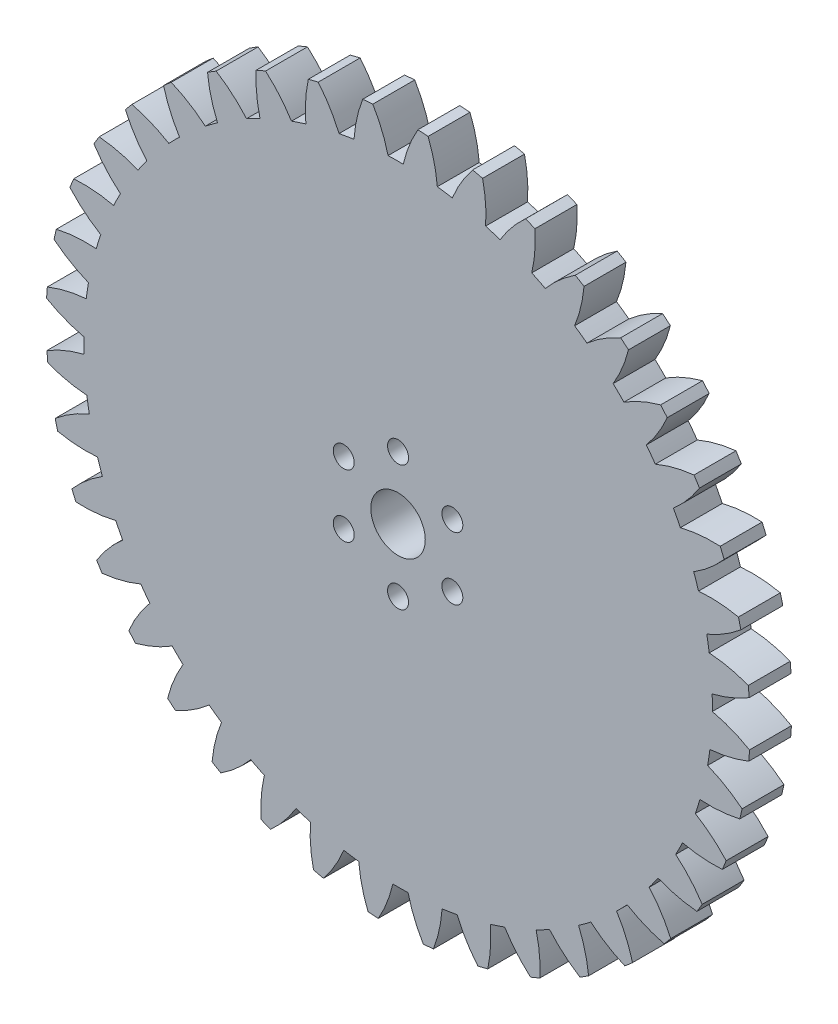
from build123d import *

# Parameters (mm, degrees)
SKETCH1_R           = 1.5875
SKETCH1_R_2         = 4.125
BOSS_EXTRUDE1_DEPTH = 6.35


with BuildPart() as part:
    # Sketch1 → Boss-Extrude1 (new body)
    with BuildSketch(Plane.XY):
        with BuildLine():
            ThreePointArc((-53.25531002, 3.004588931), (-50.519604915, 1.682221979), (-47.617299719, 0.782576864))
            ThreePointArc((-47.617299719, 0.782576864), (-47.622325401, -0.365762868), (-47.599661726, -1.513889932))
            ThreePointArc((-47.599661726, -1.513889932), (-50.487805909, -2.458008545), (-53.202876617, -3.822240134))
            ThreePointArc((-53.202876617, -3.822240134), (-53.141860267, -4.59328721), (-53.069670044, -5.363368478))
            ThreePointArc((-53.069670044, -5.363368478), (-50.160782241, -6.241496333), (-47.153473737, -6.676044764))
            ThreePointArc((-47.153473737, -6.676044764), (-46.978797632, -7.811032718), (-46.776806341, -8.941479053))
            ThreePointArc((-46.776806341, -8.941479053), (-49.481699987, -10.325779289), (-51.94993083, -12.097945558))
            ThreePointArc((-51.94993083, -12.097945558), (-51.769047356, -12.849954704), (-51.577278663, -13.599261955))
            ThreePointArc((-51.577278663, -13.599261955), (-48.566834635, -14.011528292), (-45.528572737, -13.970280013))
            ThreePointArc((-45.528572737, -13.970280013), (-45.178495952, -15.06396902), (-44.802150741, -16.148899285))
            ThreePointArc((-44.802150741, -16.148899285), (-47.257190391, -17.939295078), (-49.417805334, -20.075759411))
            ThreePointArc((-49.417805334, -20.075759411), (-49.121508687, -20.790213667), (-48.814883506, -21.50029647))
            ThreePointArc((-48.814883506, -21.50029647), (-45.777010376, -21.436549923), (-42.782607176, -20.920520604))
            ThreePointArc((-42.782607176, -20.920520604), (-42.265749762, -21.945980409), (-41.7243175, -22.958680021))
            ThreePointArc((-41.7243175, -22.958680021), (-43.869051929, -25.111085885), (-45.668849463, -27.55924144))
            ThreePointArc((-45.668849463, -27.55924144), (-45.264435449, -28.218548571), (-44.85050391, -28.87192233))
            ThreePointArc((-44.85050391, -28.87192233), (-41.860004196, -28.333732551), (-38.983191839, -27.355628546))
            ThreePointArc((-38.983191839, -27.355628546), (-38.312280542, -28.287608927), (-37.619093087, -29.203141859))
            ThreePointArc((-37.619093087, -29.203141859), (-39.400711816, -31.664558419), (-40.795374951, -34.36412348))
            ThreePointArc((-40.795374951, -34.36412348), (-40.292801587, -34.952049157), (-39.781756057, -35.532625642))
            ThreePointArc((-39.781756057, -35.532625642), (-36.912265787, -34.533244649), (-34.223880941, -33.117150126))
            ThreePointArc((-34.223880941, -33.117150126), (-33.415435823, -33.932702631), (-32.587561751, -34.728525425))
            ThreePointArc((-32.587561751, -34.728525425), (-33.962195415, -37.438344436), (-34.917382916, -40.322846753))
            ThreePointArc((-34.917382916, -40.322846753), (-34.329025225, -40.824914293), (-33.733449343, -41.318397784))
            ThreePointArc((-33.733449343, -41.318397784), (-31.05562489, -39.882433654), (-28.621864512, -38.06321756))
            ThreePointArc((-28.621864512, -38.06321756), (-27.695792175, -38.742260581), (-26.753616493, -39.398777438))
            ThreePointArc((-26.753616493, -39.398777438), (-27.687417049, -42.290274162), (-28.17960903, -45.288687715))
            ThreePointArc((-28.17960903, -45.288687715), (-27.519954331, -45.69253455), (-26.85451315, -46.086773845))
            ThreePointArc((-26.85451315, -46.086773845), (-24.434291441, -44.249584781), (-22.315082788, -42.072042252))
            ThreePointArc((-22.315082788, -42.072042252), (-21.294186206, -42.597855497), (-20.260908408, -43.098900794))
            ThreePointArc((-20.260908408, -43.098900794), (-20.730882585, -46.100876985), (-20.747959646, -49.13937088))
            ThreePointArc((-20.747959646, -49.13937088), (-20.033250828, -49.435052961), (-19.314329719, -49.720340581))
            ThreePointArc((-19.314329719, -49.720340581), (-17.211304643, -47.527164275), (-15.458829666, -45.044913636))
            ThreePointArc((-15.458829666, -45.044913636), (-14.368246702, -45.404549836), (-13.269309515, -45.737786174))
            ThreePointArc((-13.269309515, -45.737786174), (-13.263884991, -48.776323216), (-12.805426638, -51.780079651))
            ThreePointArc((-12.805426638, -51.780079651), (-12.053262203, -51.960316303), (-11.298563389, -52.12962752))
            ThreePointArc((-11.298563389, -52.12962752), (-9.564518404, -49.63446725), (-8.221928853, -46.90862975))
            ThreePointArc((-8.221928853, -46.90862975), (-7.088513278, -47.09323347), (-5.950976183, -47.250455464))
            ThreePointArc((-5.950976183, -47.250455464), (-5.470286528, -50.25073449), (-4.547581527, -53.145791012))
            ThreePointArc((-4.547581527, -53.145791012), (-3.77648226, -53.20614421), (-3.004588931, -53.25531002))
            ThreePointArc((-3.004588931, -53.25531002), (-1.682221979, -50.519604915), (-0.782576864, -47.617299719))
            ThreePointArc((-0.782576864, -47.617299719), (0.365762868, -47.622325401), (1.513889932, -47.599661726))
            ThreePointArc((1.513889932, -47.599661726), (2.458008545, -50.487805909), (3.822240134, -53.202876617))
            ThreePointArc((3.822240134, -53.202876617), (4.59328721, -53.141860267), (5.363368478, -53.069670044))
            ThreePointArc((5.363368478, -53.069670044), (6.241496333, -50.160782241), (6.676044764, -47.153473737))
            ThreePointArc((6.676044764, -47.153473737), (7.811032718, -46.978797632), (8.941479053, -46.776806341))
            ThreePointArc((8.941479053, -46.776806341), (10.325779289, -49.481699987), (12.097945558, -51.94993083))
            ThreePointArc((12.097945558, -51.94993083), (12.849954704, -51.769047356), (13.599261955, -51.577278663))
            ThreePointArc((13.599261955, -51.577278663), (14.011528292, -48.566834635), (13.970280013, -45.528572737))
            ThreePointArc((13.970280013, -45.528572737), (15.06396902, -45.178495952), (16.148899285, -44.802150741))
            ThreePointArc((16.148899285, -44.802150741), (17.939295078, -47.257190391), (20.075759411, -49.417805334))
            ThreePointArc((20.075759411, -49.417805334), (20.790213667, -49.121508687), (21.50029647, -48.814883506))
            ThreePointArc((21.50029647, -48.814883506), (21.436549923, -45.777010376), (20.920520604, -42.782607176))
            ThreePointArc((20.920520604, -42.782607176), (21.945980409, -42.265749762), (22.958680021, -41.7243175))
            ThreePointArc((22.958680021, -41.7243175), (25.111085885, -43.869051929), (27.55924144, -45.668849463))
            ThreePointArc((27.55924144, -45.668849463), (28.218548571, -45.264435449), (28.87192233, -44.85050391))
            ThreePointArc((28.87192233, -44.85050391), (28.333732551, -41.860004196), (27.355628546, -38.983191839))
            ThreePointArc((27.355628546, -38.983191839), (28.287608927, -38.312280542), (29.203141859, -37.619093087))
            ThreePointArc((29.203141859, -37.619093087), (31.664558419, -39.400711816), (34.36412348, -40.795374951))
            ThreePointArc((34.36412348, -40.795374951), (34.952049157, -40.292801587), (35.532625642, -39.781756057))
            ThreePointArc((35.532625642, -39.781756057), (34.533244649, -36.912265787), (33.117150126, -34.223880941))
            ThreePointArc((33.117150126, -34.223880941), (33.932702631, -33.415435823), (34.728525425, -32.587561751))
            ThreePointArc((34.728525425, -32.587561751), (37.438344436, -33.962195415), (40.322846753, -34.917382916))
            ThreePointArc((40.322846753, -34.917382916), (40.824914293, -34.329025225), (41.318397784, -33.733449343))
            ThreePointArc((41.318397784, -33.733449343), (39.882433654, -31.05562489), (38.06321756, -28.621864512))
            ThreePointArc((38.06321756, -28.621864512), (38.742260581, -27.695792175), (39.398777438, -26.753616493))
            ThreePointArc((39.398777438, -26.753616493), (42.290274162, -27.687417049), (45.288687715, -28.17960903))
            ThreePointArc((45.288687715, -28.17960903), (45.69253455, -27.519954331), (46.086773845, -26.85451315))
            ThreePointArc((46.086773845, -26.85451315), (44.249584781, -24.434291441), (42.072042252, -22.315082788))
            ThreePointArc((42.072042252, -22.315082788), (42.597855497, -21.294186206), (43.098900794, -20.260908408))
            ThreePointArc((43.098900794, -20.260908408), (46.100876985, -20.730882585), (49.13937088, -20.747959646))
            ThreePointArc((49.13937088, -20.747959646), (49.435052961, -20.033250828), (49.720340581, -19.314329719))
            ThreePointArc((49.720340581, -19.314329719), (47.527164275, -17.211304643), (45.044913636, -15.458829666))
            ThreePointArc((45.044913636, -15.458829666), (45.404549836, -14.368246702), (45.737786174, -13.269309515))
            ThreePointArc((45.737786174, -13.269309515), (48.776323216, -13.263884991), (51.780079651, -12.805426638))
            ThreePointArc((51.780079651, -12.805426638), (51.960316303, -12.053262203), (52.12962752, -11.298563389))
            ThreePointArc((52.12962752, -11.298563389), (49.63446725, -9.564518404), (46.90862975, -8.221928853))
            ThreePointArc((46.90862975, -8.221928853), (47.09323347, -7.088513278), (47.250455464, -5.950976183))
            ThreePointArc((47.250455464, -5.950976183), (50.25073449, -5.470286528), (53.145791012, -4.547581527))
            ThreePointArc((53.145791012, -4.547581527), (53.20614421, -3.77648226), (53.25531002, -3.004588931))
            ThreePointArc((53.25531002, -3.004588931), (50.519604915, -1.682221979), (47.617299719, -0.782576864))
            ThreePointArc((47.617299719, -0.782576864), (47.622325401, 0.365762868), (47.599661726, 1.513889932))
            ThreePointArc((47.599661726, 1.513889932), (50.487805909, 2.458008545), (53.202876617, 3.822240134))
            ThreePointArc((53.202876617, 3.822240134), (53.141860267, 4.59328721), (53.069670044, 5.363368478))
            ThreePointArc((53.069670044, 5.363368478), (50.160782241, 6.241496333), (47.153473737, 6.676044764))
            ThreePointArc((47.153473737, 6.676044764), (46.978797632, 7.811032718), (46.776806341, 8.941479053))
            ThreePointArc((46.776806341, 8.941479053), (49.481699987, 10.325779289), (51.94993083, 12.097945558))
            ThreePointArc((51.94993083, 12.097945558), (51.769047356, 12.849954704), (51.577278663, 13.599261955))
            ThreePointArc((51.577278663, 13.599261955), (48.566834635, 14.011528292), (45.528572737, 13.970280013))
            ThreePointArc((45.528572737, 13.970280013), (45.178495952, 15.06396902), (44.802150741, 16.148899285))
            ThreePointArc((44.802150741, 16.148899285), (47.257190391, 17.939295078), (49.417805334, 20.075759411))
            ThreePointArc((49.417805334, 20.075759411), (49.121508687, 20.790213667), (48.814883506, 21.50029647))
            ThreePointArc((48.814883506, 21.50029647), (45.777010376, 21.436549923), (42.782607176, 20.920520604))
            ThreePointArc((42.782607176, 20.920520604), (42.265749762, 21.945980409), (41.7243175, 22.958680021))
            ThreePointArc((41.7243175, 22.958680021), (43.869051929, 25.111085885), (45.668849463, 27.55924144))
            ThreePointArc((45.668849463, 27.55924144), (45.264435449, 28.218548571), (44.85050391, 28.87192233))
            ThreePointArc((44.85050391, 28.87192233), (41.860004196, 28.333732551), (38.983191839, 27.355628546))
            ThreePointArc((38.983191839, 27.355628546), (38.312280542, 28.287608927), (37.619093087, 29.203141859))
            ThreePointArc((37.619093087, 29.203141859), (39.400711816, 31.664558419), (40.795374951, 34.36412348))
            ThreePointArc((40.795374951, 34.36412348), (40.292801587, 34.952049157), (39.781756057, 35.532625642))
            ThreePointArc((39.781756057, 35.532625642), (36.912265787, 34.533244649), (34.223880941, 33.117150126))
            ThreePointArc((34.223880941, 33.117150126), (33.415435823, 33.932702631), (32.587561751, 34.728525425))
            ThreePointArc((32.587561751, 34.728525425), (33.962195415, 37.438344436), (34.917382916, 40.322846753))
            ThreePointArc((34.917382916, 40.322846753), (34.329025225, 40.824914293), (33.733449343, 41.318397784))
            ThreePointArc((33.733449343, 41.318397784), (31.05562489, 39.882433654), (28.621864512, 38.06321756))
            ThreePointArc((28.621864512, 38.06321756), (27.695792175, 38.742260581), (26.753616493, 39.398777438))
            ThreePointArc((26.753616493, 39.398777438), (27.687417049, 42.290274162), (28.17960903, 45.288687715))
            ThreePointArc((28.17960903, 45.288687715), (27.519954331, 45.69253455), (26.85451315, 46.086773845))
            ThreePointArc((26.85451315, 46.086773845), (24.434291441, 44.249584781), (22.315082788, 42.072042252))
            ThreePointArc((22.315082788, 42.072042252), (21.294186206, 42.597855497), (20.260908408, 43.098900794))
            ThreePointArc((20.260908408, 43.098900794), (20.730882585, 46.100876985), (20.747959646, 49.13937088))
            ThreePointArc((20.747959646, 49.13937088), (20.033250828, 49.435052961), (19.314329719, 49.720340581))
            ThreePointArc((19.314329719, 49.720340581), (17.211304643, 47.527164275), (15.458829666, 45.044913636))
            ThreePointArc((15.458829666, 45.044913636), (14.368246702, 45.404549836), (13.269309515, 45.737786174))
            ThreePointArc((13.269309515, 45.737786174), (13.263884991, 48.776323216), (12.805426638, 51.780079651))
            ThreePointArc((12.805426638, 51.780079651), (12.053262203, 51.960316303), (11.298563389, 52.12962752))
            ThreePointArc((11.298563389, 52.12962752), (9.564518404, 49.63446725), (8.221928853, 46.90862975))
            ThreePointArc((8.221928853, 46.90862975), (7.088513278, 47.09323347), (5.950976183, 47.250455464))
            ThreePointArc((5.950976183, 47.250455464), (5.470286528, 50.25073449), (4.547581527, 53.145791012))
            ThreePointArc((4.547581527, 53.145791012), (3.77648226, 53.20614421), (3.004588931, 53.25531002))
            ThreePointArc((3.004588931, 53.25531002), (1.682221979, 50.519604915), (0.782576864, 47.617299719))
            ThreePointArc((0.782576864, 47.617299719), (-0.365762868, 47.622325401), (-1.513889932, 47.599661726))
            ThreePointArc((-1.513889932, 47.599661726), (-2.458008545, 50.487805909), (-3.822240134, 53.202876617))
            ThreePointArc((-3.822240134, 53.202876617), (-4.59328721, 53.141860267), (-5.363368478, 53.069670044))
            ThreePointArc((-5.363368478, 53.069670044), (-6.241496333, 50.160782241), (-6.676044764, 47.153473737))
            ThreePointArc((-6.676044764, 47.153473737), (-7.811032718, 46.978797632), (-8.941479053, 46.776806341))
            ThreePointArc((-8.941479053, 46.776806341), (-10.325779289, 49.481699987), (-12.097945558, 51.94993083))
            ThreePointArc((-12.097945558, 51.94993083), (-12.849954704, 51.769047356), (-13.599261955, 51.577278663))
            ThreePointArc((-13.599261955, 51.577278663), (-14.011528292, 48.566834635), (-13.970280013, 45.528572737))
            ThreePointArc((-13.970280013, 45.528572737), (-15.06396902, 45.178495952), (-16.148899285, 44.802150741))
            ThreePointArc((-16.148899285, 44.802150741), (-17.939295078, 47.257190391), (-20.075759411, 49.417805334))
            ThreePointArc((-20.075759411, 49.417805334), (-20.790213667, 49.121508687), (-21.50029647, 48.814883506))
            ThreePointArc((-21.50029647, 48.814883506), (-21.436549923, 45.777010376), (-20.920520604, 42.782607176))
            ThreePointArc((-20.920520604, 42.782607176), (-21.945980409, 42.265749762), (-22.958680021, 41.7243175))
            ThreePointArc((-22.958680021, 41.7243175), (-25.111085885, 43.869051929), (-27.55924144, 45.668849463))
            ThreePointArc((-27.55924144, 45.668849463), (-28.218548571, 45.264435449), (-28.87192233, 44.85050391))
            ThreePointArc((-28.87192233, 44.85050391), (-28.333732551, 41.860004196), (-27.355628546, 38.983191839))
            ThreePointArc((-27.355628546, 38.983191839), (-28.287608927, 38.312280542), (-29.203141859, 37.619093087))
            ThreePointArc((-29.203141859, 37.619093087), (-31.664558419, 39.400711816), (-34.36412348, 40.795374951))
            ThreePointArc((-34.36412348, 40.795374951), (-34.952049157, 40.292801587), (-35.532625642, 39.781756057))
            ThreePointArc((-35.532625642, 39.781756057), (-34.533244649, 36.912265787), (-33.117150126, 34.223880941))
            ThreePointArc((-33.117150126, 34.223880941), (-33.932702631, 33.415435823), (-34.728525425, 32.587561751))
            ThreePointArc((-34.728525425, 32.587561751), (-37.438344436, 33.962195415), (-40.322846753, 34.917382916))
            ThreePointArc((-40.322846753, 34.917382916), (-40.824914293, 34.329025225), (-41.318397784, 33.733449343))
            ThreePointArc((-41.318397784, 33.733449343), (-39.882433654, 31.05562489), (-38.06321756, 28.621864512))
            ThreePointArc((-38.06321756, 28.621864512), (-38.742260581, 27.695792175), (-39.398777438, 26.753616493))
            ThreePointArc((-39.398777438, 26.753616493), (-42.290274162, 27.687417049), (-45.288687715, 28.17960903))
            ThreePointArc((-45.288687715, 28.17960903), (-45.69253455, 27.519954331), (-46.086773845, 26.85451315))
            ThreePointArc((-46.086773845, 26.85451315), (-44.249584781, 24.434291441), (-42.072042252, 22.315082788))
            ThreePointArc((-42.072042252, 22.315082788), (-42.597855497, 21.294186206), (-43.098900794, 20.260908408))
            ThreePointArc((-43.098900794, 20.260908408), (-46.100876985, 20.730882585), (-49.13937088, 20.747959646))
            ThreePointArc((-49.13937088, 20.747959646), (-49.435052961, 20.033250828), (-49.720340581, 19.314329719))
            ThreePointArc((-49.720340581, 19.314329719), (-47.527164275, 17.211304643), (-45.044913636, 15.458829666))
            ThreePointArc((-45.044913636, 15.458829666), (-45.404549836, 14.368246702), (-45.737786174, 13.269309515))
            ThreePointArc((-45.737786174, 13.269309515), (-48.776323216, 13.263884991), (-51.780079651, 12.805426638))
            ThreePointArc((-51.780079651, 12.805426638), (-51.960316303, 12.053262203), (-52.12962752, 11.298563389))
            ThreePointArc((-52.12962752, 11.298563389), (-49.63446725, 9.564518404), (-46.90862975, 8.221928853))
            ThreePointArc((-46.90862975, 8.221928853), (-47.09323347, 7.088513278), (-47.250455464, 5.950976183))
            ThreePointArc((-47.250455464, 5.950976183), (-50.25073449, 5.470286528), (-53.145791012, 4.547581527))
            ThreePointArc((-53.145791012, 4.547581527), (-53.20614421, 3.77648226), (-53.25531002, 3.004588931))
        make_face()
        with Locations((0, 9.5)):
            Circle(SKETCH1_R, mode=Mode.SUBTRACT)
        with Locations((8.227241336, 4.75)):
            Circle(SKETCH1_R, mode=Mode.SUBTRACT)
        with Locations((8.227241336, -4.75)):
            Circle(SKETCH1_R, mode=Mode.SUBTRACT)
        with Locations((0, -9.5)):
            Circle(SKETCH1_R, mode=Mode.SUBTRACT)
        with Locations((-8.227241336, -4.75)):
            Circle(SKETCH1_R, mode=Mode.SUBTRACT)
        with Locations((-8.227241336, 4.75)):
            Circle(SKETCH1_R, mode=Mode.SUBTRACT)
        Circle(SKETCH1_R_2, mode=Mode.SUBTRACT)
    extrude(amount=BOSS_EXTRUDE1_DEPTH)


solid = part.part
